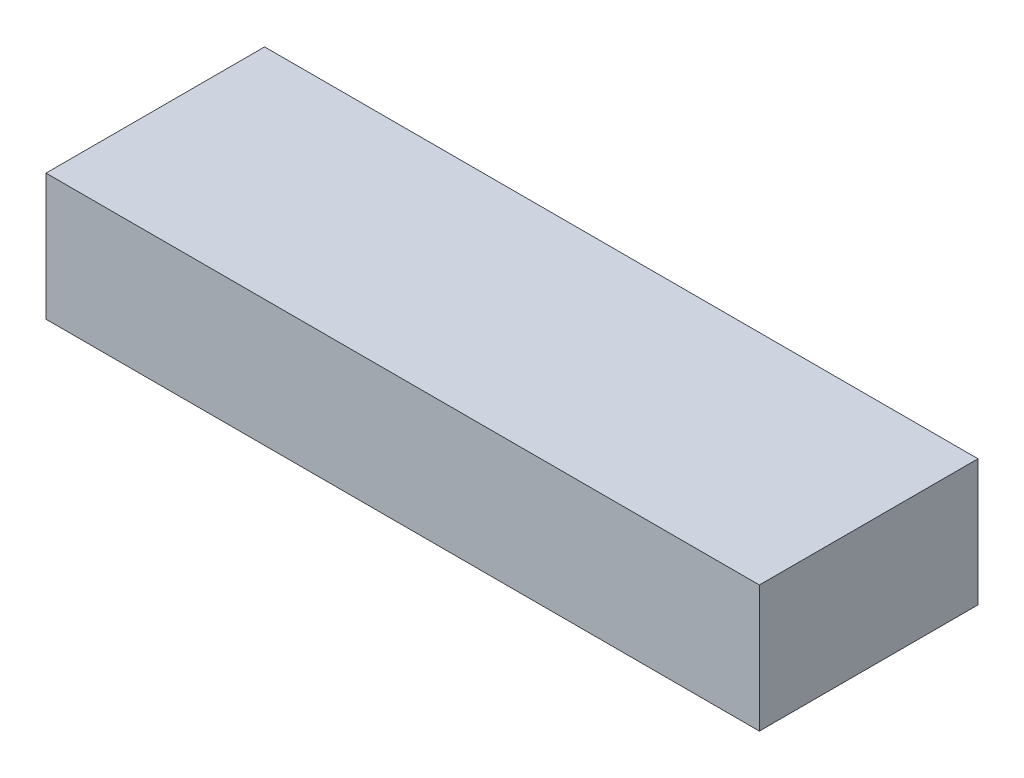
from build123d import *

# Parameters (mm, degrees)
SKETCH1_W           = 62
SKETCH1_H           = 11
BOSS_EXTRUDE1_DEPTH = 19


with BuildPart() as part:
    # Sketch1 → Boss-Extrude1 (new body)
    with BuildSketch(Plane.XY):
        with Locations((31, 5.5)):
            Rectangle(SKETCH1_W, SKETCH1_H)
    extrude(amount=BOSS_EXTRUDE1_DEPTH)


solid = part.part
